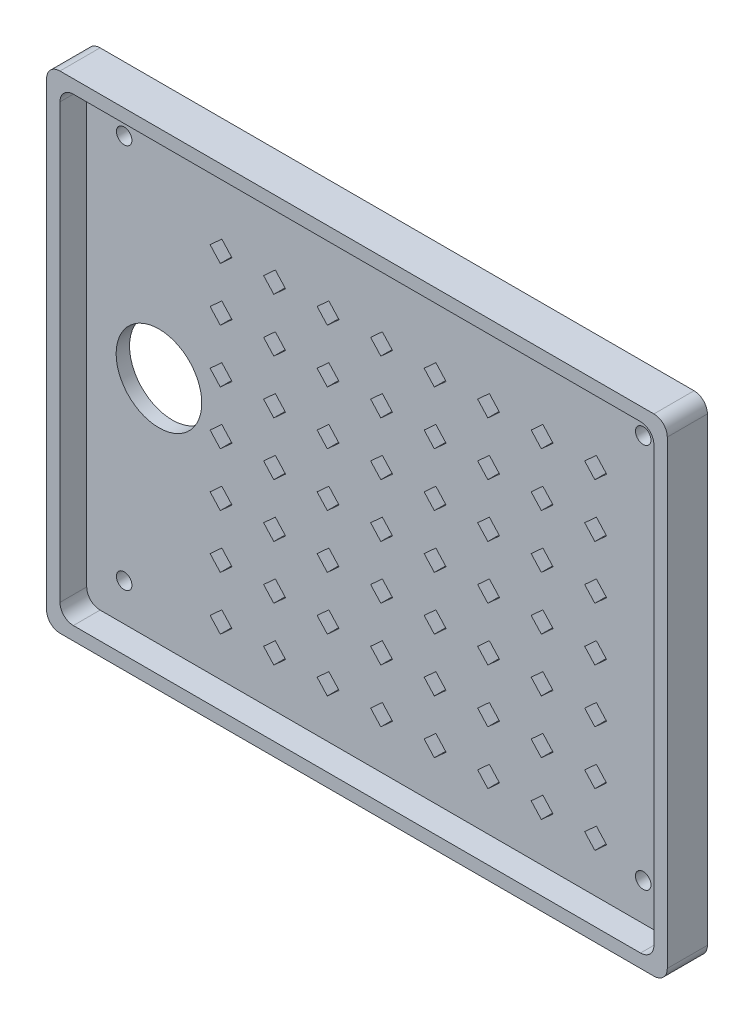
from build123d import *

# Parameters (mm, degrees)
SKETCH1_W                  = 116
SKETCH1_H                  = 91
LID_EXTRUDE_DEPTH          = 2.5
SKETCH3_W                  = 111
SKETCH3_H                  = 2.5
SKETCH3_W_2                = 2.5
SKETCH3_H_2                = 86
RAILS_DEPTH                = 5
EDGE_FILLETS_R             = 2.5
SKETCH5_R                  = 8
BUTTON_HOLE_DEPTH          = 5
LID_AIRFLOW_HOLE_DEPTH     = 5
AIRFLOW_PATTERN_COUNT      = 8
AIRFLOW_PATTERN_PITCH      = 10
AIRFLOW_PATTERN_COUNT_DIR2 = 7
AIRFLOW_PATTERN_PITCH_DIR2 = 10
SKETCH6_R                  = 1.45
MOUNTING_HOLES_DEPTH       = 2.5


with BuildPart() as part:
    # Sketch1 → Lid Extrude (new body)
    with BuildSketch(Plane.XY):
        Rectangle(SKETCH1_W, SKETCH1_H)
    extrude(amount=LID_EXTRUDE_DEPTH)

    # Sketch3 → Rails (add)
    with BuildSketch(Plane.XY.offset(2.5)):
        with Locations((0, 44.25)):
            Rectangle(SKETCH3_W, SKETCH3_H)
        with Locations((-56.75, 44.25)):
            Rectangle(SKETCH3_W_2, SKETCH3_H)
        with Locations((-56.75, 0)):
            Rectangle(SKETCH3_W_2, SKETCH3_H_2)
        with Locations((-56.75, -44.25)):
            Rectangle(SKETCH3_W_2, SKETCH3_H)
        with Locations((0, -44.25)):
            Rectangle(SKETCH3_W, SKETCH3_H)
        with Locations((56.75, -44.25)):
            Rectangle(SKETCH3_W_2, SKETCH3_H)
        with Locations((56.75, 0)):
            Rectangle(SKETCH3_W_2, SKETCH3_H_2)
        with Locations((56.75, 44.25)):
            Rectangle(SKETCH3_W_2, SKETCH3_H)
    extrude(amount=RAILS_DEPTH)

    # Edge Fillets
    edge_fillets_edges = [part.edges().sort_by_distance(p)[0] for p in [
        (55.5, 43, 5),
        (55.5, -43, 5),
        (-55.5, -43, 5),
        (-55.5, 43, 5),
        (-58, 45.5, 3.75),
        (58, 45.5, 3.75),
        (58, -45.5, 3.75),
        (-58, -45.5, 3.75),
    ]]
    fillet(edge_fillets_edges, radius=EDGE_FILLETS_R)

    # Sketch5 → Button Hole (cut)
    with BuildSketch(Plane(origin=(0, 0, 0), x_dir=(-1, 0, 0), z_dir=(0, 0, -1))):
        with Locations((42, 0)):
            Circle(SKETCH5_R)
    extrude(amount=-BUTTON_HOLE_DEPTH, mode=Mode.SUBTRACT)

    # Sketch2 → Lid Airflow Hole (cut)
    with BuildSketch(Plane.XY.offset(2.5)):
        Polygon((-32.442153548, -33.579373192), (-30.25, -31.579373192), (-28.343674481, -33.668852317), (-30.535828028, -35.668852317), align=None)
    lid_airflow_hole = extrude(amount=-LID_AIRFLOW_HOLE_DEPTH, mode=Mode.SUBTRACT)

    # Airflow Pattern: Lid Airflow Hole 8 × 7
    with Locations(*[(i * AIRFLOW_PATTERN_PITCH, j * AIRFLOW_PATTERN_PITCH_DIR2, 0) for i in range(AIRFLOW_PATTERN_COUNT) for j in range(AIRFLOW_PATTERN_COUNT_DIR2) if (i, j) != (0, 0)]):
        add(lid_airflow_hole, mode=Mode.SUBTRACT)

    # Sketch6 → Mounting Holes (cut)
    with BuildSketch(Plane(origin=(0, 0, 0), x_dir=(-1, 0, 0), z_dir=(0, 0, -1))):
        with Locations((48.5, -36)):
            Circle(SKETCH6_R)
        with Locations((48.5, 36)):
            Circle(SKETCH6_R)
        with Locations((-48.5, -36)):
            Circle(SKETCH6_R)
        with Locations((-48.5, 36)):
            Circle(SKETCH6_R)
    extrude(amount=-MOUNTING_HOLES_DEPTH, mode=Mode.SUBTRACT)


solid = part.part
